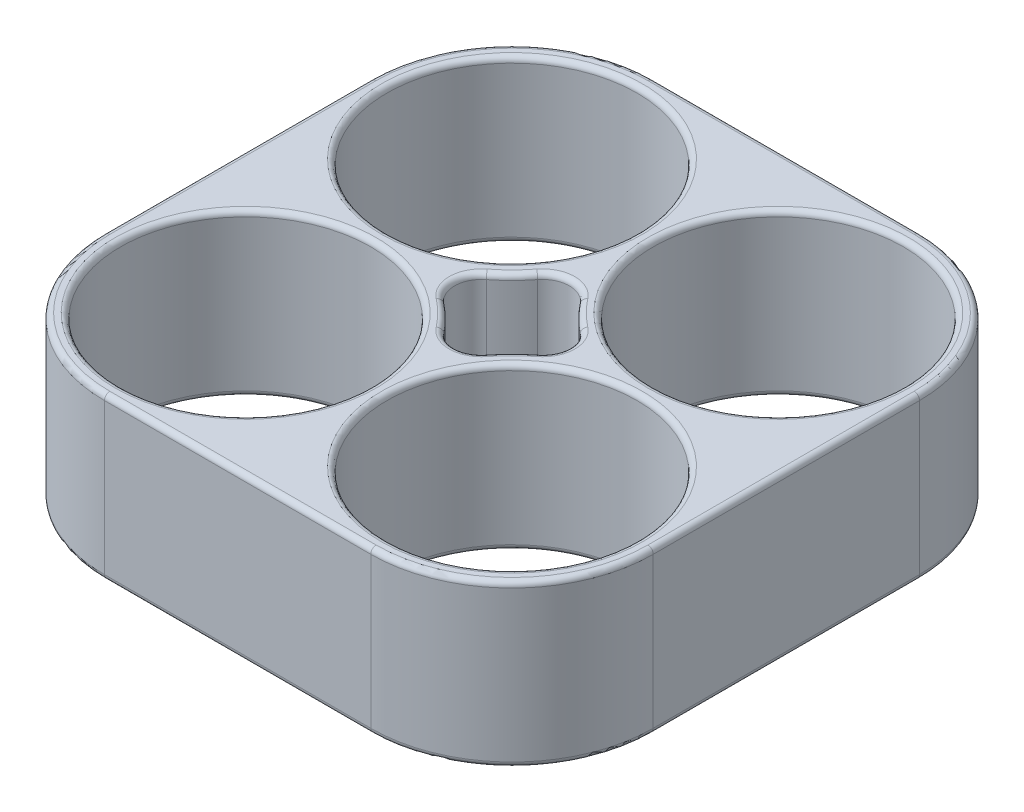
from build123d import *

# Parameters (mm, degrees)
ESQUISSE1_R        = 9.3
BOSS_EXTRU_1_DEPTH = 12
CONG_1_R           = 0.4


with BuildPart() as part:
    # Esquisse1 → Boss.-Extru.1 (new body)
    with BuildSketch(Plane(origin=(0, 0, 0), x_dir=(1, 0, 0), z_dir=(0, 1, 0))):
        with BuildLine():
            Line((-10.5, 19.8), (-10.5, 0))
            ThreePointArc((-10.5, 0), (-7.424621202, -7.424621202), (0, -10.5))
            Line((0, -10.5), (19.8, -10.5))
            ThreePointArc((19.8, -10.5), (27.224621202, -7.424621202), (30.3, 0))
            Line((30.3, 0), (30.3, 19.8))
            ThreePointArc((30.3, 19.8), (27.224621202, 27.224621202), (19.8, 30.3))
            Line((19.8, 30.3), (0, 30.3))
            ThreePointArc((0, 30.3), (-7.424621202, 27.224621202), (-10.5, 19.8))
        make_face()
        with Locations(Location((0, 0, 0), (0, 0, 270))):
            Circle(ESQUISSE1_R, mode=Mode.SUBTRACT)
        with Locations(Location((0, 19.8, 0), (0, 0, 270))):
            Circle(ESQUISSE1_R, mode=Mode.SUBTRACT)
        with Locations(Location((19.8, 0, 0), (0, 0, 270))):
            Circle(ESQUISSE1_R, mode=Mode.SUBTRACT)
        with Locations(Location((19.8, 19.8, 0), (0, 0, 270))):
            Circle(ESQUISSE1_R, mode=Mode.SUBTRACT)
        with BuildLine():
            ThreePointArc((6.410471434, 11.484), (7.424621202, 12.375378798), (8.316, 13.389528566))
            ThreePointArc((8.316, 13.389528566), (9.9, 14.168486389), (11.484, 13.389528566))
            ThreePointArc((11.484, 13.389528566), (12.375378798, 12.375378798), (13.389528566, 11.484))
            ThreePointArc((13.389528566, 11.484), (14.168486389, 9.9), (13.389528566, 8.316))
            ThreePointArc((13.389528566, 8.316), (12.375378798, 7.424621202), (11.484, 6.410471434))
            ThreePointArc((11.484, 6.410471434), (9.9, 5.631513611), (8.316, 6.410471434))
            ThreePointArc((8.316, 6.410471434), (7.424621202, 7.424621202), (6.410471434, 8.316))
            ThreePointArc((6.410471434, 8.316), (5.631513611, 9.9), (6.410471434, 11.484))
        make_face(mode=Mode.SUBTRACT)
    extrude(amount=BOSS_EXTRU_1_DEPTH)

    # Congé1
    cong_1_edges = [part.edges().sort_by_distance(p)[0] for p in [
        (9.9, 0, 10.5),
        (-7.424621202, 0, 7.424621202),
        (-10.5, 0, -9.9),
        (-7.424621202, 0, -27.224621202),
        (-7.424621202, 12, 7.424621202),
        (9.9, 12, 10.5),
        (27.224621202, 12, 7.424621202),
        (0, 0, -9.3),
        (0, 12, -9.3),
        (30.3, 12, -9.9),
        (0, 0, -29.1),
        (0, 12, -29.1),
        (27.224621202, 12, -27.224621202),
        (9.9, 12, -30.3),
        (5.631513611, 0, -9.9),
        (7.424621202, 0, -7.424621202),
        (9.9, 0, -5.631513611),
        (12.375378798, 0, -7.424621202),
        (14.168486389, 0, -9.9),
        (12.375378798, 0, -12.375378798),
        (9.9, 0, -14.168486389),
        (7.424621202, 0, -12.375378798),
        (5.631513611, 12, -9.9),
        (7.424621202, 12, -7.424621202),
        (9.9, 12, -5.631513611),
        (12.375378798, 12, -7.424621202),
        (14.168486389, 12, -9.9),
        (12.375378798, 12, -12.375378798),
        (9.9, 12, -14.168486389),
        (7.424621202, 12, -12.375378798),
        (-7.424621202, 12, -27.224621202),
        (19.8, 0, -9.3),
        (19.8, 12, -9.3),
        (19.8, 0, -29.1),
        (19.8, 12, -29.1),
        (9.9, 0, -30.3),
        (-10.5, 12, -9.9),
        (27.224621202, 0, -27.224621202),
        (30.3, 0, -9.9),
        (27.224621202, 0, 7.424621202),
    ]]
    fillet(cong_1_edges, radius=CONG_1_R)


solid = part.part
